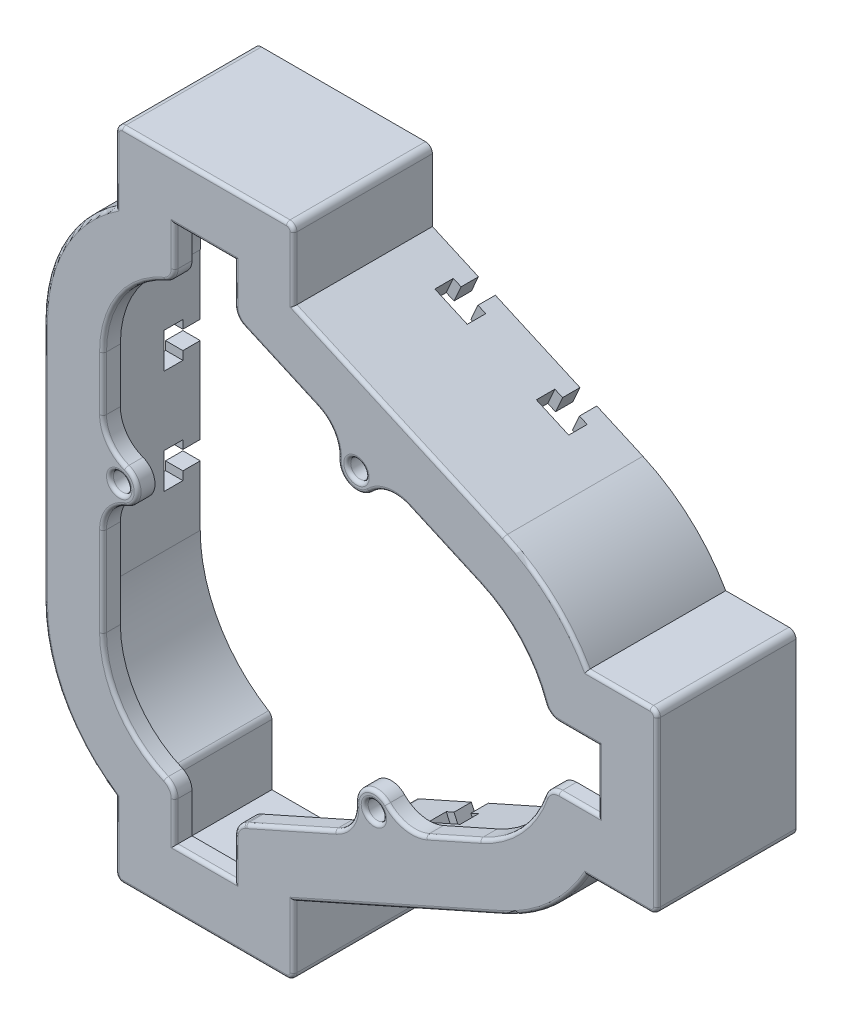
from build123d import *

# Parameters (mm, degrees)
SKETCH1_R           = 3.3782
BOSS_EXTRUDE1_DEPTH = 6.35
BOSS_EXTRUDE2_DEPTH = 50.8
CUT_EXTRUDE1_DEPTH  = 18.542
CUT_EXTRUDE2_DEPTH  = 18.542
FILLET1_R           = 12.7
FILLET2_R           = 2.54
FILLET3_R           = 1.27


with BuildPart() as part:
    # Sketch1 → Boss-Extrude1 (new body)
    with BuildSketch(Plane(origin=(0, 0, -80.01), x_dir=(-1, 0, 0), z_dir=(0, 0, -1))):
        with BuildLine():
            ThreePointArc((50.683048569, -56.46165664), (69.915897636, -35.299677671), (76.876798569, -7.563821901))
            Line((76.876798569, -7.563821901), (76.876798569, 81.336178099))
            ThreePointArc((76.876798569, 81.336178099), (69.915897636, 109.072033869), (50.683048569, 130.234012838))
            Line((50.683048569, 130.234012838), (50.683048569, 156.759312576))
            Line((50.683048569, 156.759312576), (-14.404451431, 156.759312576))
            Line((-14.404451431, 156.759312576), (-14.404451431, 131.142265008))
            Line((-14.404451431, 131.142265008), (-91.374286117, 96.866854622))
            ThreePointArc((-91.374286117, 96.866854622), (-108.722690302, 85.568449718), (-121.690697129, 69.429928099))
            Line((-121.690697129, 69.429928099), (-147.37728746, 69.429928099))
            Line((-147.37728746, 69.429928099), (-147.37728746, 4.342428099))
            Line((-147.37728746, 4.342428099), (-121.690697129, 4.342428099))
            ThreePointArc((-121.690697129, 4.342428099), (-108.722690302, -11.79609352), (-91.374286117, -23.094498424))
            Line((-91.374286117, -23.094498424), (-14.404451431, -57.36990881))
            Line((-14.404451431, -57.36990881), (-14.404451431, -82.986956378))
            Line((-14.404451431, -82.986956378), (50.683048569, -82.986956378))
            Line((50.683048569, -82.986956378), (50.683048569, -56.46165664))
        make_face()
        with BuildLine():
            Line((55.286798569, 39.965228132), (55.286798569, -7.563821901))
            ThreePointArc((55.286798569, -7.563821901), (49.095548569, -28.097875134), (32.585548569, -41.787243956))
            ThreePointArc((32.585548569, -41.787243956), (30.045548569, -43.893300698), (29.093048569, -47.052385811))
            Line((29.093048569, -47.052385811), (29.093048569, -61.396956378))
            Line((29.093048569, -61.396956378), (7.185548569, -61.396956378))
            Line((7.185548569, -61.396956378), (7.185548569, -47.052385811))
            ThreePointArc((7.185548569, -47.052385811), (6.233048569, -43.893300698), (3.693048569, -41.787243956))
            ThreePointArc((3.693048569, -41.787243956), (3.359698295, -41.6446108), (3.027756074, -41.498730766))
            Line((3.027756074, -41.498730766), (-43.20886125, -20.909118743))
            ThreePointArc((-43.20886125, -20.909118743), (-41.056532995, -8.006979176), (-49.205885333, -18.238586029))
            Line((-49.205885333, -18.238586029), (-82.591509282, -3.371645409))
            ThreePointArc((-82.591509282, -3.371645409), (-97.010075674, 6.955786784), (-106.189719626, 22.130932563))
            ThreePointArc((-106.189719626, 22.130932563), (-108.278986772, 24.886309283), (-111.574858962, 25.932428099))
            Line((-111.574858962, 25.932428099), (-125.78728746, 25.932428099))
            Line((-125.78728746, 25.932428099), (-125.78728746, 47.839928099))
            Line((-125.78728746, 47.839928099), (-111.574858962, 47.839928099))
            ThreePointArc((-111.574858962, 47.839928099), (-108.278986772, 48.886046915), (-106.189719626, 51.641423635))
            ThreePointArc((-106.189719626, 51.641423635), (-97.010075674, 66.816569414), (-82.591509282, 77.144001607))
            Line((-82.591509282, 77.144001607), (-42.831573178, 94.849484962))
            ThreePointArc((-42.831573178, 94.849484962), (-34.681993695, 84.618180325), (-36.833945366, 97.520286522))
            Line((-36.833945366, 97.520286522), (3.027756074, 115.271086964))
            ThreePointArc((3.027756074, 115.271086964), (3.359698295, 115.416966998), (3.693048569, 115.559600155))
            ThreePointArc((3.693048569, 115.559600155), (6.233048569, 117.665656896), (7.185548569, 120.824742009))
            Line((7.185548569, 120.824742009), (7.185548569, 135.169312576))
            Line((7.185548569, 135.169312576), (29.093048569, 135.169312576))
            Line((29.093048569, 135.169312576), (29.093048569, 120.824742009))
            ThreePointArc((29.093048569, 120.824742009), (30.045548569, 117.665656896), (32.585548569, 115.559600155))
            ThreePointArc((32.585548569, 115.559600155), (49.095548569, 101.870231332), (55.286798569, 81.336178099))
            Line((55.286798569, 81.336178099), (55.286798569, 46.52998577))
            ThreePointArc((55.286798569, 46.52998577), (42.624898569, 43.247606951), (55.286798569, 39.965228132))
        make_face(mode=Mode.SUBTRACT)
        with Locations((49.381298569, 43.247606951)):
            Circle(SKETCH1_R, mode=Mode.SUBTRACT)
        with Locations((-43.80502551, -14.179072002)):
            Circle(SKETCH1_R, mode=Mode.SUBTRACT)
        with Locations((-37.430486211, 90.790273151)):
            Circle(SKETCH1_R, mode=Mode.SUBTRACT)
    extrude(amount=BOSS_EXTRUDE1_DEPTH)

    # Sketch1<3> → Boss-Extrude2 (add)
    with BuildSketch(Plane(origin=(0, 0, -80.01), x_dir=(-1, 0, 0), z_dir=(0, 0, -1))):
        with BuildLine():
            ThreePointArc((50.683048569, -56.46165664), (69.915897636, -35.299677671), (76.876798569, -7.563821901))
            Line((76.876798569, -7.563821901), (76.876798569, 81.336178099))
            ThreePointArc((76.876798569, 81.336178099), (69.915897636, 109.072033869), (50.683048569, 130.234012838))
            Line((50.683048569, 130.234012838), (50.683048569, 156.759312576))
            Line((50.683048569, 156.759312576), (22.108048569, 156.759312576))
            Line((22.108048569, 156.759312576), (14.170548569, 156.759312576))
            Line((14.170548569, 156.759312576), (-14.404451431, 156.759312576))
            Line((-14.404451431, 156.759312576), (-14.404451431, 131.142265008))
            Line((-14.404451431, 131.142265008), (-91.374286117, 96.866854622))
            ThreePointArc((-91.374286117, 96.866854622), (-108.722690302, 85.568449718), (-121.690697129, 69.429928099))
            Line((-121.690697129, 69.429928099), (-147.37728746, 69.429928099))
            Line((-147.37728746, 69.429928099), (-147.37728746, 40.854928099))
            Line((-147.37728746, 40.854928099), (-147.37728746, 32.917428099))
            Line((-147.37728746, 32.917428099), (-147.37728746, 4.342428099))
            Line((-147.37728746, 4.342428099), (-121.690697129, 4.342428099))
            ThreePointArc((-121.690697129, 4.342428099), (-108.722690302, -11.79609352), (-91.374286117, -23.094498424))
            Line((-91.374286117, -23.094498424), (-14.404451431, -57.36990881))
            Line((-14.404451431, -57.36990881), (-14.404451431, -82.986956378))
            Line((-14.404451431, -82.986956378), (14.170548569, -82.986956378))
            Line((14.170548569, -82.986956378), (22.108048569, -82.986956378))
            Line((22.108048569, -82.986956378), (50.683048569, -82.986956378))
            Line((50.683048569, -82.986956378), (50.683048569, -56.46165664))
        make_face()
        with BuildLine():
            Line((70.526798569, 81.336178099), (70.526798569, -7.563821901))
            ThreePointArc((70.526798569, -7.563821901), (63.50820441, -33.757571901), (44.333048569, -52.932727742))
            Line((44.333048569, -52.932727742), (44.333048569, -76.636956378))
            Line((44.333048569, -76.636956378), (22.108048569, -76.636956378))
            Line((22.108048569, -76.636956378), (14.170548569, -76.636956378))
            Line((14.170548569, -76.636956378), (-8.054451431, -76.636956378))
            Line((-8.054451431, -76.636956378), (-8.054451431, -53.246475601))
            Line((-8.054451431, -53.246475601), (-88.791116459, -17.293659302))
            ThreePointArc((-88.791116459, -17.293659302), (-105.787319824, -5.850874875), (-117.875635297, 10.692428099))
            Line((-117.875635297, 10.692428099), (-141.02728746, 10.692428099))
            Line((-141.02728746, 10.692428099), (-141.02728746, 32.917428099))
            Line((-141.02728746, 32.917428099), (-141.02728746, 40.854928099))
            Line((-141.02728746, 40.854928099), (-141.02728746, 63.079928099))
            Line((-141.02728746, 63.079928099), (-117.875635297, 63.079928099))
            ThreePointArc((-117.875635297, 63.079928099), (-105.787319824, 79.623231073), (-88.791116459, 91.0660155))
            Line((-88.791116459, 91.0660155), (-8.054451431, 127.018831799))
            Line((-8.054451431, 127.018831799), (-8.054451431, 150.409312576))
            Line((-8.054451431, 150.409312576), (14.170548569, 150.409312576))
            Line((14.170548569, 150.409312576), (22.108048569, 150.409312576))
            Line((22.108048569, 150.409312576), (44.333048569, 150.409312576))
            Line((44.333048569, 150.409312576), (44.333048569, 126.70508394))
            ThreePointArc((44.333048569, 126.70508394), (63.50820441, 107.529928099), (70.526798569, 81.336178099))
        make_face(mode=Mode.SUBTRACT)
    extrude(amount=BOSS_EXTRUDE2_DEPTH)

    # Sketch3 → Cut-Extrude1 (cut)
    with BuildSketch(Plane(origin=(51.118496229, 114.793146454, 0), x_dir=(0.9135179719941336, -0.40679837124025636, 0), z_dir=(0.40679837124025636, 0.9135179719941336, 0))):
        Polygon((18.880319655, 130.81), (18.880319655, 124.46), (15.781519655, 124.46), (15.781519655, 117.7036), (28.735519655, 117.7036), (28.735519655, 124.46), (25.636719655, 124.46), (25.636719655, 130.81), align=None)
        Polygon((-21.759680345, 130.81), (-21.759680345, 124.46), (-24.858480345, 124.46), (-24.858480345, 117.7036), (-11.904480345, 117.7036), (-11.904480345, 124.46), (-15.003280345, 124.46), (-15.003280345, 130.81), align=None)
    cut_extrude1 = extrude(amount=-CUT_EXTRUDE1_DEPTH, mode=Mode.SUBTRACT)

    # Mirror1: Cut-Extrude1 across plane
    add(cut_extrude1.mirror(Plane.ZX.offset(36.886178099)), mode=Mode.SUBTRACT)

    # Sketch2 → Cut-Extrude2 (cut)
    with BuildSketch(Plane.ZY.offset(76.876798569)):
        Polygon((-130.81, 395.457978099), (-130.81, 402.214378099), (-124.46, 402.214378099), (-124.46, 405.313178099), (-117.602, 405.313178099), (-117.602, 392.359178099), (-124.46, 392.359178099), (-124.46, 395.457978099), align=None)
        Polygon((-130.81, 52.557978099), (-124.46, 52.557978099), (-124.46, 49.459178099), (-117.602, 49.459178099), (-117.602, 62.413178099), (-124.46, 62.413178099), (-124.46, 59.314378099), (-130.81, 59.314378099), align=None)
        Polygon((-130.81, 14.457978099), (-124.46, 14.457978099), (-124.46, 11.359178099), (-117.602, 11.359178099), (-117.602, 24.313178099), (-124.46, 24.313178099), (-124.46, 21.214378099), (-130.81, 21.214378099), align=None)
        Polygon((-130.81, 433.557978099), (-130.81, 440.314378099), (-124.46, 440.314378099), (-124.46, 443.413178099), (-117.602, 443.413178099), (-117.602, 430.459178099), (-124.46, 430.459178099), (-124.46, 433.557978099), align=None)
    extrude(amount=-CUT_EXTRUDE2_DEPTH, mode=Mode.SUBTRACT)

    # Fillet1
    fillet1_edges = [part.edges().sort_by_distance(p)[0] for p in [
        (49.205885333, -18.238586029, -83.185),
        (43.20886125, -20.909118743, -83.185),
        (-55.286798569, 46.52998577, -83.185),
        (-55.286798569, 39.965228132, -83.185),
        (42.831573178, 94.849484962, -83.185),
        (36.833945366, 97.520286522, -83.185),
    ]]
    fillet(fillet1_edges, radius=FILLET1_R)

    # Fillet2
    fillet2_edges = [part.edges().sort_by_distance(p)[0] for p in [
        (141.02728746, 63.079928099, -108.585),
        (141.02728746, 10.692428099, -108.585),
        (8.054451431, 150.409312576, -108.585),
        (-44.333048569, 150.409312576, -108.585),
        (8.054451431, 127.018831799, -108.585),
        (-44.333048569, 126.70508394, -108.585),
        (8.054451431, -53.246475601, -108.585),
        (-44.333048569, -52.932727742, -108.585),
        (14.404451431, -82.986956378, -105.41),
        (-50.683048569, -82.986956378, -105.41),
        (-50.683048569, 156.759312576, -105.41),
        (14.404451431, 156.759312576, -105.41),
        (147.37728746, 69.429928099, -105.41),
        (147.37728746, 4.342428099, -105.41),
        (117.875635297, 10.692428099, -108.585),
        (117.875635297, 63.079928099, -108.585),
    ]]
    fillet(fillet2_edges, radius=FILLET2_R)

    # Fillet3
    fillet3_edges = [part.edges().sort_by_distance(p)[0] for p in [
        (-49.939099793, -82.243007602, -80.01),
        (-50.683048569, -68.454306509, -80.01),
        (-69.915897636, -35.299677671, -80.01),
        (-76.876798569, 36.886178099, -80.01),
        (-69.915897636, 109.072033869, -80.01),
        (-50.683048569, 142.226662707, -80.01),
        (-49.939099793, 156.0153638, -80.01),
        (-18.139298569, 156.759312576, -80.01),
        (13.660502655, 156.0153638, -80.01),
        (14.404451431, 142.680788792, -80.01),
        (52.889368774, 114.004559815, -80.01),
        (108.722690302, 85.568449718, -80.01),
        (133.263992294, 69.429928099, -80.01),
        (146.633338684, 68.685979323, -80.01),
        (147.37728746, 36.886178099, -80.01),
        (146.633338684, 5.086376875, -80.01),
        (133.263992294, 4.342428099, -80.01),
        (108.722690302, -11.79609352, -80.01),
        (52.889368774, -40.232203617, -80.01),
        (14.404451431, -68.908432594, -80.01),
        (13.660502655, -82.243007602, -80.01),
        (-18.139298569, -82.986956378, -80.01),
        (40.808686211, 90.790273151, -80.01),
        (-46.003098569, 43.247606951, -80.01),
        (47.18322551, -14.179072002, -80.01),
        (118.681073211, 47.839928099, -80.01),
        (108.278986772, 48.886046915, -80.01),
        (97.010075674, 66.816569414, -80.01),
        (69.539487909, 82.956192717, -80.01),
        (48.946581244, 89.642743872, -80.01),
        (34.681993695, 84.618180325, -80.01),
        (28.872986983, 98.58170917, -80.01),
        (10.075147968, 109.43623731, -80.01),
        (-3.359698295, 115.416966998, -80.01),
        (-6.233048569, 117.665656896, -80.01),
        (-7.185548569, 127.997027293, -80.01),
        (-18.139298569, 135.169312576, -80.01),
        (-29.093048569, 127.997027293, -80.01),
        (-30.045548569, 117.665656896, -80.01),
        (-49.095548569, 101.870231332, -80.01),
        (-55.286798569, 71.407624403, -80.01),
        (-53.017885837, 54.234595681, -80.01),
        (-42.624898569, 43.247606951, -80.01),
        (-53.017885837, 32.260618221, -80.01),
        (-55.286798569, 8.726160647, -80.01),
        (-49.095548569, -28.097875134, -80.01),
        (-30.045548569, -43.893300698, -80.01),
        (-29.093048569, -54.224671095, -80.01),
        (-18.139298569, -61.396956378, -80.01),
        (-7.185548569, -54.224671095, -80.01),
        (-6.233048569, -43.893300698, -80.01),
        (-3.359698295, -41.6446108, -80.01),
        (13.26242371, -34.244556457, -80.01),
        (35.247571624, -21.970648949, -80.01),
        (41.056532995, -8.006979176, -80.01),
        (55.321194951, -13.031670708, -80.01),
        (72.726826185, -7.764484017, -80.01),
        (97.010075674, 6.955786784, -80.01),
        (108.278986772, 24.886309283, -80.01),
        (118.681073211, 25.932428099, -80.01),
        (125.78728746, 36.886178099, -80.01),
    ]]
    fillet(fillet3_edges, radius=FILLET3_R)


solid = part.part
